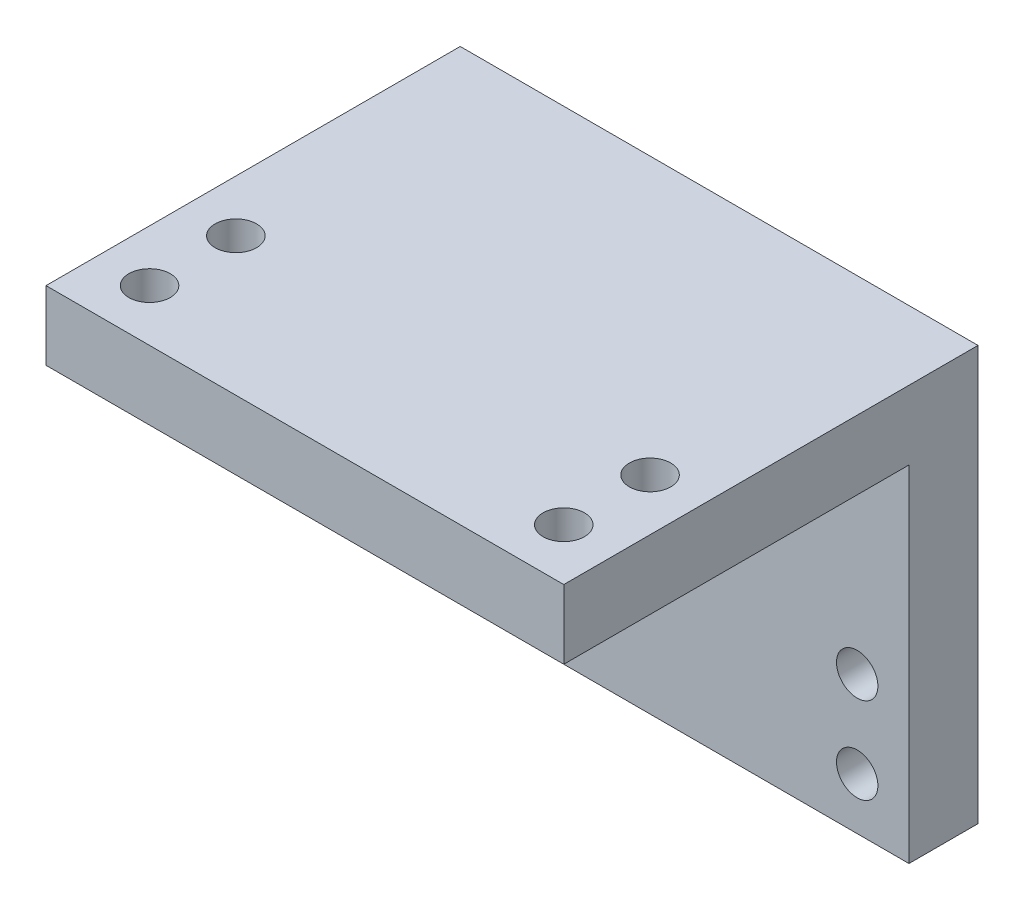
from build123d import *

# Parameters (mm, degrees)
BOSS_EXTRUDE1_DEPTH = 38.1
SKETCH2_R           = 1.524
CUT_EXTRUDE1_DEPTH  = 69.008036544
SKETCH3_R           = 1.524
CUT_EXTRUDE2_DEPTH  = 57.404583684


with BuildPart() as part:
    # Sketch1 → Boss-Extrude1 (new body)
    with BuildSketch(Plane(origin=(0, 0, 0), x_dir=(0, 0, -1), z_dir=(1, 0, 0))):
        Polygon((-2.180942408, -16.89565445), (28.299057592, -16.89565445), (28.299057592, -47.37565445), (23.219057592, -47.37565445), (23.219057592, -21.97565445), (-2.180942408, -21.97565445), align=None)
    extrude(amount=BOSS_EXTRUDE1_DEPTH)

    # Sketch2 → Cut-Extrude1 (cut, through all)
    with BuildSketch(Plane(origin=(0, 0, -28.299057592), x_dir=(-1, 0, 0), z_dir=(0, 0, -1))):
        with Locations(Location((-34.29, -43.56565445, 0), (0, 0, 90))):
            Circle(SKETCH2_R)
        with Locations(Location((-3.81, -43.56565445, 0), (0, 0, 90))):
            Circle(SKETCH2_R)
        with Locations(Location((-3.81, -37.21565445, 0), (0, 0, 90))):
            Circle(SKETCH2_R)
        with Locations(Location((-34.29, -37.21565445, 0), (0, 0, 90))):
            Circle(SKETCH2_R)
    extrude(amount=-CUT_EXTRUDE1_DEPTH, mode=Mode.SUBTRACT)

    # Sketch3 → Cut-Extrude2 (cut, through all)
    with BuildSketch(Plane(origin=(0, -16.89565445, 0), x_dir=(1, 0, 0), z_dir=(0, 1, 0))):
        with Locations(Location((3.81, 1.629057592, 0), (0, 0, 270))):
            Circle(SKETCH3_R)
        with Locations(Location((34.29, 1.629057592, 0), (0, 0, 270))):
            Circle(SKETCH3_R)
        with Locations(Location((3.81, 7.979057592, 0), (0, 0, 270))):
            Circle(SKETCH3_R)
        with Locations(Location((34.29, 7.979057592, 0), (0, 0, 270))):
            Circle(SKETCH3_R)
    extrude(amount=-CUT_EXTRUDE2_DEPTH, mode=Mode.SUBTRACT)


solid = part.part
